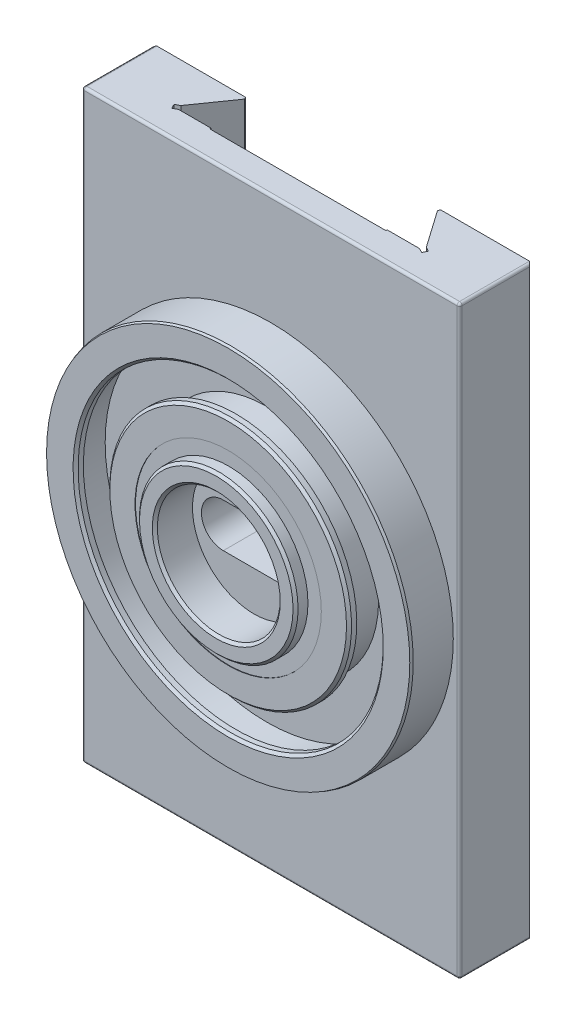
from build123d import *
from OCP.BRepFilletAPI import BRepFilletAPI_MakeChamfer

# Parameters (mm, degrees)
BOSS_EXTRUDE1_DEPTH = 147.6375
CUT_EXTRUDE1_DEPTH  = 313.398864885
SKETCH2_R           = 92.075
BOSS_EXTRUDE2_DEPTH = 21.4875
SKETCH5_R           = 40
BOSS_EXTRUDE3_DEPTH = 6
CUT_EXTRUDE4_START  = -0.254
SKETCH8_R           = 46.99
SKETCH8_R_2         = 40
CUT_EXTRUDE4_DEPTH  = 0.254
SKETCH6_R           = 31
CUT_EXTRUDE2_DEPTH  = 19
CUT_EXTRUDE3_DEPTH  = 38.1
CHAMFER3_SIZE       = 1.27
CHAMFER1_SIZE       = 1.27
CHAMFER1_SIZE2      = 1.329072894
FILLET1_R           = 1.27
CHAMFER2_SIZE       = 1.27
CHAMFER2_SIZE2      = 0.462242198
CHAMFER4_SIZE       = 1.27


with BuildPart() as part:
    # Sketch1 → Boss-Extrude1 (new, symmetric)
    with BuildSketch(Plane(origin=(0, 0, 0), x_dir=(1, 0, 0), z_dir=(0, 1, 0))):
        Polygon((-95.25, 36.5125), (-95.25, 0), (95.25, 0), (95.25, 36.5125), (47.937887463, 36.5125), (63.5, 14.2875), (44.45, 14.2875), (44.45, 13.6525), (-44.45, 13.6525), (-44.45, 14.2875), (-63.5, 14.2875), (-47.937887463, 36.5125), align=None)
    extrude(amount=BOSS_EXTRUDE1_DEPTH, both=True)

    # Sketch3 → Cut-Extrude1 (cut, through all)
    with BuildSketch(Plane(origin=(0, 147.6375, 0), x_dir=(1, 0, 0), z_dir=(0, 1, 0))):
        Polygon((-61.922427153, 16.540507516), (-64.17543467, 15.367666039), (-63.002593192, 13.114658522), (-60.749585676, 14.2875), align=None)
        Polygon((64.17543467, 15.367666039), (61.922427153, 16.540507516), (60.749585676, 14.2875), (63.002593192, 13.114658522), align=None)
    extrude(amount=-CUT_EXTRUDE1_DEPTH, mode=Mode.SUBTRACT)

    # Sketch2 → Boss-Extrude2 (add)
    with BuildSketch(Plane.XY):
        with Locations(Location((0, 0, 0), (0, 0, 180))):
            Circle(SKETCH2_R)
    extrude(amount=BOSS_EXTRUDE2_DEPTH)

    # Sketch4 → Cut-Revolve1 (revolve, cut)
    with BuildSketch(Plane(origin=(0, 0, 0), x_dir=(0, 0, -1), z_dir=(1, 0, 0))):
        Polygon((-28.064444951, 76.96), (-17.564444869, 76.96), (-17.564444869, 81.46), (-2.064444951, 81.46), (-2.064444951, 56.46), (-17.564444869, 56.46), (-17.564444869, 60.96), (-28.064444951, 60.96), align=None)
    revolve(axis=Axis((0, 0, 0), (0, 0, 1)), mode=Mode.SUBTRACT)

    # Sketch5 → Boss-Extrude3 (add)
    with BuildSketch(Plane.XY.offset(21.4875)):
        Circle(SKETCH5_R)
    extrude(amount=BOSS_EXTRUDE3_DEPTH)

    # Sketch8 → Cut-Extrude4 (cut)
    with BuildSketch(Plane.XY.offset(21.4875).offset(CUT_EXTRUDE4_START)):
        Circle(SKETCH8_R)
        Circle(SKETCH8_R_2, mode=Mode.SUBTRACT)
    extrude(amount=CUT_EXTRUDE4_DEPTH, mode=Mode.SUBTRACT)

    # Sketch6 → Cut-Extrude2 (cut)
    with BuildSketch(Plane.XY.offset(27.4875)):
        Circle(SKETCH6_R)
    extrude(amount=-CUT_EXTRUDE2_DEPTH, mode=Mode.SUBTRACT)

    # Sketch7 → Cut-Extrude3 (cut)
    with BuildSketch(Plane.XY.offset(8.4875)):
        with BuildLine():
            Line((15.45, -11.05), (-15.45, -11.05))
            ThreePointArc((-15.45, -11.05), (-26.5, 0), (-15.45, 11.05))
            Line((-15.45, 11.05), (15.45, 11.05))
            ThreePointArc((15.45, 11.05), (26.5, 0), (15.45, -11.05))
        make_face()
    extrude(amount=-CUT_EXTRUDE3_DEPTH, mode=Mode.SUBTRACT)

    # Chamfer3
    chamfer3_edges = [part.edges().sort_by_distance(p)[0] for p in [
        (95.25, 0, -36.5125),
        (-95.25, 0, -36.5125),
    ]]
    chamfer(chamfer3_edges, length=CHAMFER3_SIZE)

    # Chamfer1: one chamfer whose edges measure the first distance from different faces: ONE call of the kernel's chamfer builder (chamfer() names one face for all edges)
    chamfer1_edges_1 = [part.edges().sort_by_distance(p)[0] for p in [
        (47.937887463, 0, -36.5125),
    ]]
    chamfer1_side_1 = [part.faces().sort_by_distance(p)[0] for p in [
        (54.930157308, 0, -26.526503758),
    ]]
    chamfer1_edges_2 = [part.edges().sort_by_distance(p)[0] for p in [
        (-47.937887463, 0, -36.5125),
    ]]
    chamfer1_side_2 = [part.faces().sort_by_distance(p)[0] for p in [
        (-70.958943732, 0, -36.5125),
    ]]
    chamfer1 = BRepFilletAPI_MakeChamfer(part.part.solid().wrapped)
    for e in chamfer1_edges_1:
        chamfer1.Add(CHAMFER1_SIZE, CHAMFER1_SIZE2, e.wrapped, chamfer1_side_1[0].wrapped)  # the first distance lies on this face
    for e in chamfer1_edges_2:
        chamfer1.Add(CHAMFER1_SIZE, CHAMFER1_SIZE2, e.wrapped, chamfer1_side_2[0].wrapped)  # the first distance lies on this face
    add(Compound.cast(chamfer1.Shape()), mode=Mode.REPLACE)

    # Fillet1
    fillet1_edges = [part.edges().sort_by_distance(p)[0] for p in [
        (95.25, -147.6375, -17.62125),
        (-95.25, -147.6375, -17.62125),
        (0, -147.6375, 0),
        (95.25, 0, 0),
        (95.25, 147.6375, -17.62125),
        (-95.25, 147.6375, -17.62125),
        (0, 147.6375, 0),
        (-95.25, 0, 0),
    ]]
    fillet(fillet1_edges, radius=FILLET1_R)

    # Chamfer2
    chamfer2_edges = [part.edges().sort_by_distance(p)[0] for p in [
        (92.075, 0, 21.4875),
    ]]
    chamfer2_side = [part.faces().sort_by_distance(p)[0] for p in [
        (92.075, 0, 10.74375),
    ]]
    chamfer(chamfer2_edges, length=CHAMFER2_SIZE, length2=CHAMFER2_SIZE2, reference=chamfer2_side[0])

    # Chamfer4
    chamfer4_edges = [part.edges().sort_by_distance(p)[0] for p in [
        (0, -76.96, 21.4875),
        (0, -60.96, 21.4875),
        (-40, 0, 27.4875),
        (-31, 0, 27.4875),
    ]]
    chamfer(chamfer4_edges, length=CHAMFER4_SIZE)


solid = part.part
